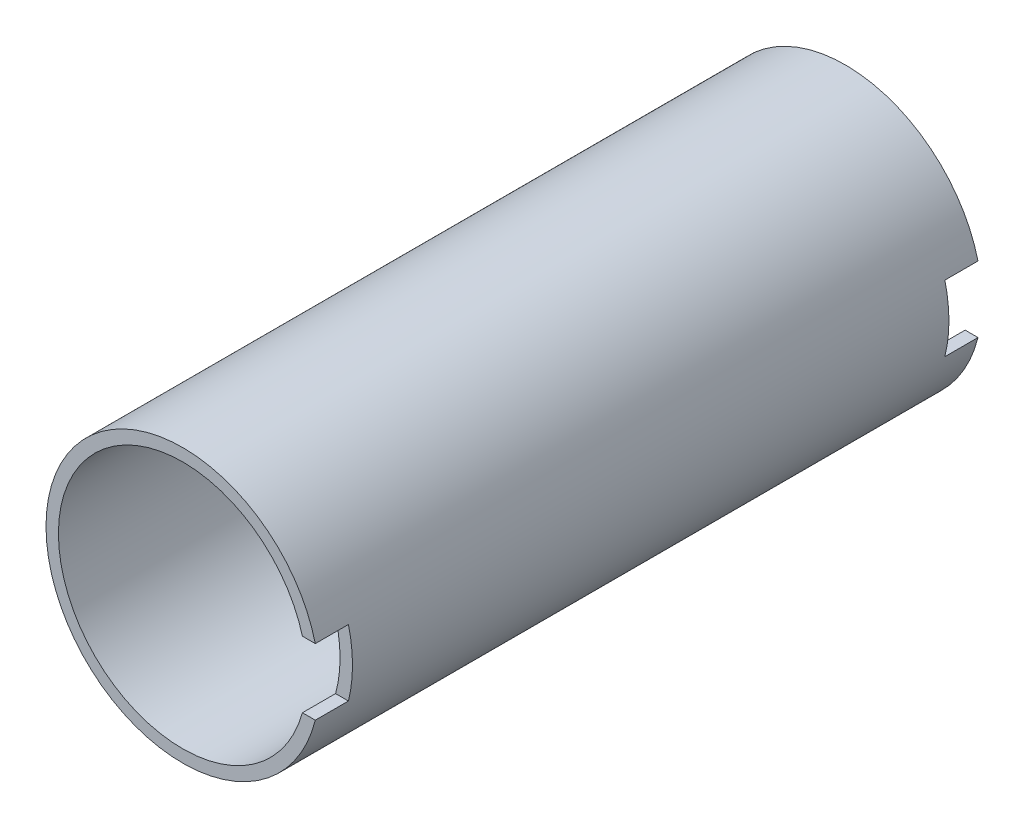
from build123d import *

# Parameters (mm, degrees)
SKETCH1_R           = 16.5
SKETCH1_R_2         = 15
BOSS_EXTRUDE1_DEPTH = 40
SKETCH3_W           = 4
SKETCH3_H           = 8
CUT_EXTRUDE1_DEPTH  = 47.308746474


with BuildPart() as part:
    # Sketch1 → Boss-Extrude1 (new, symmetric)
    with BuildSketch(Plane.XY):
        Circle(SKETCH1_R)
        Circle(SKETCH1_R_2, mode=Mode.SUBTRACT)
    extrude(amount=BOSS_EXTRUDE1_DEPTH, both=True)

    # Sketch3 → Cut-Extrude1 (cut, through all)
    with BuildSketch(Plane(origin=(0, 0, 0), x_dir=(0, 0, -1), z_dir=(1, 0, 0))):
        with Locations((-38, 0)):
            Rectangle(SKETCH3_W, SKETCH3_H)
    cut_extrude1 = extrude(amount=CUT_EXTRUDE1_DEPTH, mode=Mode.SUBTRACT)

    # Mirror1: Cut-Extrude1 across plane
    add(cut_extrude1.mirror(Plane.XY), mode=Mode.SUBTRACT)


solid = part.part
